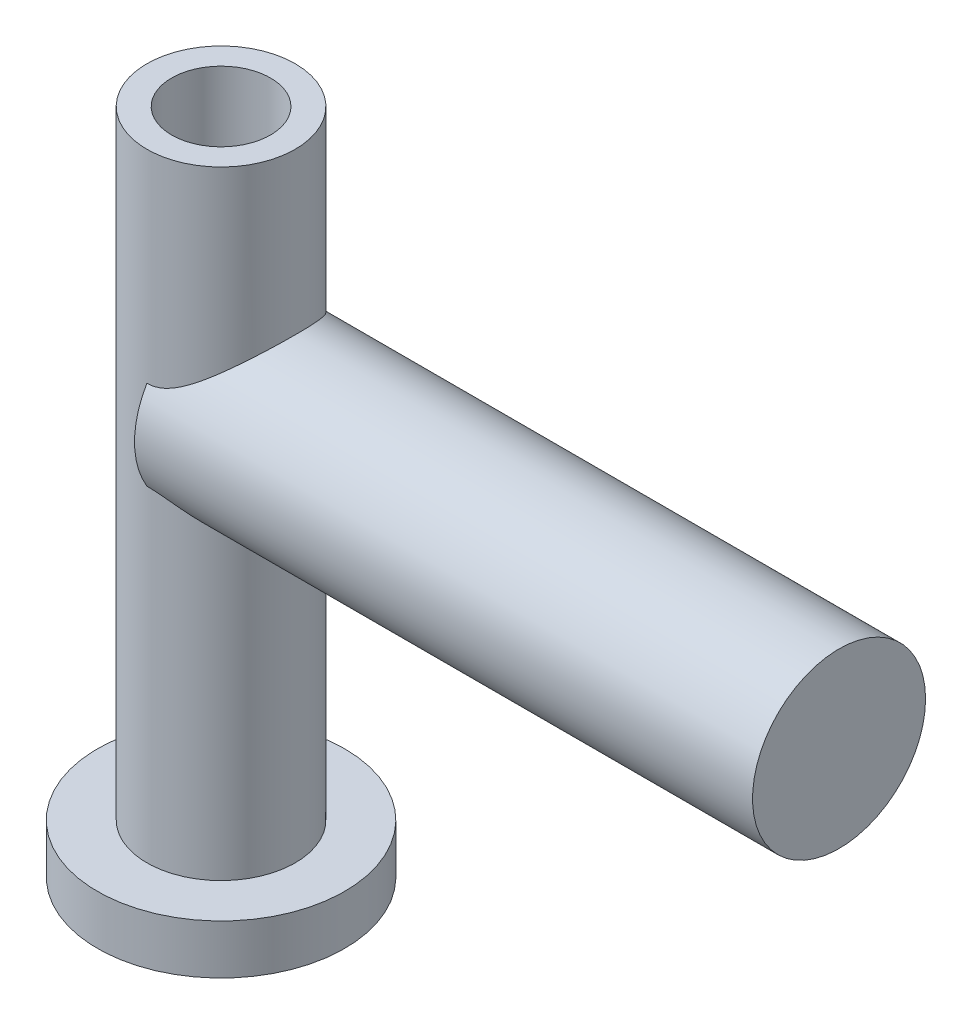
from build123d import *

# Parameters (mm, degrees)
SKETCH4_R           = 20
CUT_EXTRUDE1_DEPTH  = 300
SKETCH5_R           = 35
BOSS_EXTRUDE1_DEPTH = 250


with BuildPart() as part:
    # Sketch1 → Revolve1 (revolve)
    with BuildSketch(Plane.XY, mode=Mode.PRIVATE) as revolve1_sk:
        Polygon((0, 0), (0, 270), (30, 270), (30, 20), (50, 20), (50, 0), align=None)
    revolve(revolve1_sk.sketch.rotate(Axis((0, 0, 0), (0, 1, 0)), 90), axis=Axis((0, 0, 0), (0, 1, 0)))

    # Sketch4 → Cut-Extrude1 (cut)
    with BuildSketch(Plane(origin=(0, 270, 0), x_dir=(1, 0, 0), z_dir=(0, 1, 0))):
        with Locations(Location((0, 0, 0), (0, 0, 270))):
            Circle(SKETCH4_R)
    extrude(amount=-CUT_EXTRUDE1_DEPTH, mode=Mode.SUBTRACT)

    # Sketch5 → Boss-Extrude1 (add)
    with BuildSketch(Plane(origin=(0, 0, 0), x_dir=(0, 0, -1), z_dir=(1, 0, 0))):
        with Locations(Location((0, 170, 0), (0, 0, 211.002719134))):
            Circle(SKETCH5_R)
    extrude(amount=BOSS_EXTRUDE1_DEPTH)


solid = part.part
